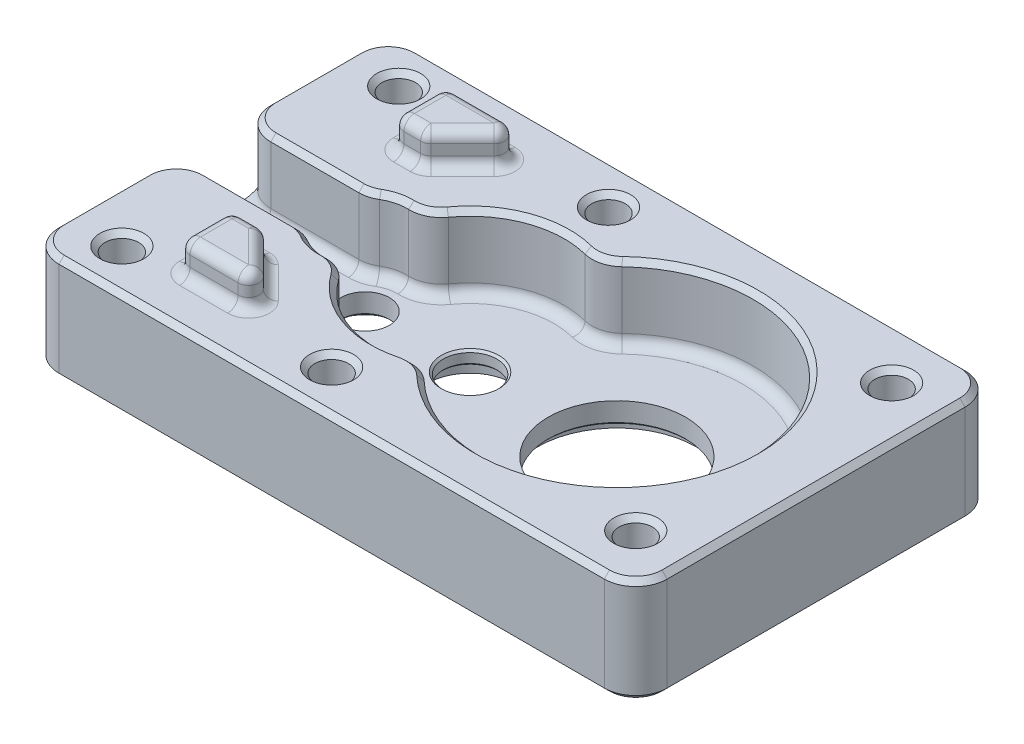
from build123d import *

# Parameters (mm, degrees)
BOSS_EXTRUDE1_DEPTH  = 3
SKETCH2_R            = 3.85
CUT_EXTRUDE1_DEPTH   = 1
SKETCH3_R            = 2.3
CUT_EXTRUDE2_DEPTH   = 47.35558218812488
BOSS_EXTRUDE2_DEPTH  = 7
CUT_EXTRUDE3_DEPTH   = 7
SKETCH6_R            = 4.099999999999999
CUT_EXTRUDE4_DEPTH   = 1.7
SKETCH7_R            = 2.5500000000000007
CUT_EXTRUDE5_DEPTH   = 48.05029224138783
SKETCH8_R            = 7.6000000000000005
CUT_EXTRUDE6_DEPTH   = 1
SKETCH9_R            = 6.550000000000002
CUT_EXTRUDE7_DEPTH   = 48.17880880225782
FILLET1_R            = 3
FILLET2_R            = 3
FILLET3_R            = 1
CHAMFER1_SIZE        = 0.2
SKETCH10_R           = 1.6
SKETCH10_R_2         = 1.6000000000000019
CUT_EXTRUDE8_DEPTH   = 48.37974265485198
SKETCH11_R           = 1.5999999999999979
CUT_EXTRUDE9_DEPTH   = 48.37974265485198
SKETCH12_R           = 2.0999999999999974
CUT_EXTRUDE10_DEPTH  = 5
BOSS_EXTRUDE3_DEPTH  = 3
FILLET4_R            = 1
FILLET5_R            = 1
FILLET4_OF_MIRROR2_R = 1
FILLET5_OF_MIRROR2_R = 1
CHAMFER2_SIZE        = 0.5


with BuildPart() as part:
    # Sketch1 → Boss-Extrude1 (new body)
    with BuildSketch(Plane(origin=(0, 27.999999999999996, 0), x_dir=(1, 0, 0), z_dir=(0, 1, 0))):
        Polygon((43, -17.199999999999992), (-15, -17.2), (-15, 17.2), (43, 17.199999999999992), align=None)
    extrude(amount=BOSS_EXTRUDE1_DEPTH)

    # Sketch2 → Cut-Extrude1 (cut)
    with BuildSketch(Plane.XZ.offset(-27.999999999999996)):
        with Locations(Location((0, 0, 0), (0, 0, 270))):
            Circle(SKETCH2_R)
    extrude(amount=-CUT_EXTRUDE1_DEPTH, mode=Mode.SUBTRACT)

    # Sketch3 → Cut-Extrude2 (cut, through all)
    with BuildSketch(Plane.XZ.offset(-28.999999999999996)):
        with Locations(Location((0, 0, 0), (0, 0, 270))):
            Circle(SKETCH3_R)
    extrude(amount=-CUT_EXTRUDE2_DEPTH, mode=Mode.SUBTRACT)

    # Sketch4 → Boss-Extrude2 (add)
    with BuildSketch(Plane(origin=(0, 30.999999999999996, 0), x_dir=(1, 0, 0), z_dir=(0, 1, 0))):
        Polygon((-15, -17.2), (43, -17.199999999999992), (43, 17.199999999999992), (-15, 17.2), align=None)
        with BuildLine():
            ThreePointArc((1.7500000000000029, 3.596873642484539), (-4.000000000000001, 4.9e-16), (1.7500000000000029, -3.596873642484539))
            ThreePointArc((1.7500000000000029, -3.596873642484539), (6.8432344422697495, -8.428216372016559), (13.85714285714286, -8.131571126147259))
            ThreePointArc((13.85714285714286, -8.131571126147259), (37, 0), (13.85714285714286, 8.131571126147259))
            ThreePointArc((13.85714285714286, 8.131571126147259), (6.843234442269749, 8.42821637201656), (1.7500000000000029, 3.596873642484539))
        make_face(mode=Mode.SUBTRACT)
    extrude(amount=BOSS_EXTRUDE2_DEPTH)

    # Sketch5 → Cut-Extrude3 (cut)
    with BuildSketch(Plane(origin=(0, 38, 0), x_dir=(1, 0, 0), z_dir=(0, 1, 0))):
        Polygon((-2.6457513110645925, 2.9999999999999982), (-2.6457513110645925, -2.9999999999999982), (-15, -3), (-15, 3), align=None)
    extrude(amount=-CUT_EXTRUDE3_DEPTH, mode=Mode.SUBTRACT)

    # Sketch6 → Cut-Extrude4 (cut)
    with BuildSketch(Plane.XZ.offset(-27.999999999999996)):
        with Locations(Location((10, 0, 0), (0, 0, 270))):
            Circle(SKETCH6_R)
    extrude(amount=-CUT_EXTRUDE4_DEPTH, mode=Mode.SUBTRACT)

    # Sketch7 → Cut-Extrude5 (cut, through all)
    with BuildSketch(Plane.XZ.offset(-29.699999999999996)):
        with Locations(Location((10, 0, 0), (0, 0, 270))):
            Circle(SKETCH7_R)
    extrude(amount=-CUT_EXTRUDE5_DEPTH, mode=Mode.SUBTRACT)

    # Sketch8 → Cut-Extrude6 (cut)
    with BuildSketch(Plane.XZ.offset(-27.999999999999996)):
        with Locations(Location((24, 0, 0), (0, 0, 270))):
            Circle(SKETCH8_R)
    extrude(amount=-CUT_EXTRUDE6_DEPTH, mode=Mode.SUBTRACT)

    # Sketch9 → Cut-Extrude7 (cut, through all)
    with BuildSketch(Plane.XZ.offset(-28.999999999999996)):
        with Locations(Location((24, 0, 0), (0, 0, 270))):
            Circle(SKETCH9_R)
    extrude(amount=-CUT_EXTRUDE7_DEPTH, mode=Mode.SUBTRACT)

    # Fillet1
    fillet1_edges = [part.edges().sort_by_distance(p)[0] for p in [
        (43, 33, 17.199999999999992),
        (43, 33, -17.199999999999992),
        (-15, 33, -17.2),
        (-15, 33, 17.2),
    ]]
    fillet(fillet1_edges, radius=FILLET1_R)

    # Fillet2
    fillet2_edges = [part.edges().sort_by_distance(p)[0] for p in [
        (1.750000000000003, 34.5, -3.596873642484539),
        (1.750000000000003, 34.5, 3.5968736424845384),
        (13.85714285714286, 34.5, 8.13157112614726),
        (13.857142857142863, 34.5, -8.131571126147264),
        (-15, 34.5, -3),
        (-2.6457513110645925, 34.5, -2.9999999999999982),
        (-2.6457513110645925, 34.5, 2.9999999999999982),
        (-15, 34.5, 3),
    ]]
    fillet(fillet2_edges, radius=FILLET2_R)

    # Fillet3
    fillet3_edges = [part.edges().sort_by_distance(p)[0] for p in [
        (-7.802775637731996, 31, 2.999999999999999),
        (-7.802775637731997, 31, -2.999999999999999),
        (6.931902414879216, 30.999999999999996, 8.460896950570664),
        (37, 30.999999999999996, 5.33e-15),
        (-1.0000331784075014, 30.999999999999996, 3.8729747794278486),
        (-1.0000331784075025, 30.999999999999996, -3.8729747794278486),
        (6.9319024148792145, 30.999999999999996, -8.460896950570664),
        (-14.121320343559642, 31, 3.878679656440358),
        (-14.121320343559642, 31, -3.8786796564403576),
        (13.75000000000006, 31, 8.714212528966701),
        (1.57203171563431, 31, 4.302537419625892),
        (-2.8037675497267185, 31, 3.1091276650217043),
        (-2.803767549726719, 31, -3.1091276650217043),
        (13.749999999999947, 31, -8.714212528966673),
        (1.5720317156342107, 31, -4.302537419625842),
    ]]
    fillet(fillet3_edges, radius=FILLET3_R)

    # Chamfer1
    chamfer1_edges = [part.edges().sort_by_distance(p)[0] for p in [
        (7e-16, 28.999999999999996, 2.3),
        (10, 31, 2.5500000000000007),
        (10, 29.699999999999996, 2.5500000000000007),
        (24.000000000000004, 28.999999999999996, 6.550000000000002),
    ]]
    chamfer(chamfer1_edges, length=CHAMFER1_SIZE)

    # Sketch10 → Cut-Extrude8 (cut, through all)
    with BuildSketch(Plane.XZ.offset(-27.999999999999996)):
        with Locations(Location((-10.000000000000004, -13.200000000000005, 0), (0, 0, 270))):
            Circle(SKETCH10_R)
        with Locations(Location((9.999999999999996, -13.200000000000005, 0), (0, 0, 270))):
            Circle(SKETCH10_R)
        with Locations(Location((-10.000000000000004, 13.199999999999994, 0), (0, 0, 270))):
            Circle(SKETCH10_R)
        with Locations(Location((9.999999999999996, 13.199999999999994, 0), (0, 0, 270))):
            Circle(SKETCH10_R_2)
    extrude(amount=-CUT_EXTRUDE8_DEPTH, mode=Mode.SUBTRACT)

    # Sketch11 → Cut-Extrude9 (cut, through all)
    with BuildSketch(Plane.XZ.offset(-27.999999999999996)):
        with Locations(Location((38.00000000000001, -12.199999999999992, 0), (0, 0, 270))):
            Circle(SKETCH11_R)
    cut_extrude9 = extrude(amount=-CUT_EXTRUDE9_DEPTH, mode=Mode.SUBTRACT)

    # Sketch12 → Cut-Extrude10 (cut)
    with BuildSketch(Plane.XZ.offset(-27.999999999999996)):
        with Locations(Location((38.00000000000001, -12.199999999999992, 0), (0, 0, 270))):
            Circle(SKETCH12_R)
    cut_extrude10 = extrude(amount=-CUT_EXTRUDE10_DEPTH, mode=Mode.SUBTRACT)

    # Mirror1: Cut-Extrude9, Cut-Extrude10 across plane
    add(cut_extrude9.mirror(Plane.XY), mode=Mode.SUBTRACT)
    add(cut_extrude10.mirror(Plane.XY), mode=Mode.SUBTRACT)

    # Sketch13 → Boss-Extrude3 (add)
    with BuildSketch(Plane(origin=(0, 38, 0), x_dir=(1, 0, 0), z_dir=(0, 1, 0))):
        Polygon((3.000000000000001, -12.7), (-4.999999999999999, -12.700000000000001), (-4.999999999999999, -7.700000000000001), (-2.0000000000000533, -7.700000000000001), align=None)
    boss_extrude3 = extrude(amount=BOSS_EXTRUDE3_DEPTH)

    # Fillet4
    fillet4_edges = [part.edges().sort_by_distance(p)[0] for p in [
        (3.000000000000001, 39.5, 12.7),
        (-2.0000000000000533, 39.5, 7.700000000000001),
        (-4.999999999999999, 39.5, 7.700000000000001),
        (-4.999999999999999, 39.5, 12.700000000000001),
        (0.4999999999999738, 41, 10.2),
        (-3.500000000000026, 41, 7.700000000000001),
        (-4.999999999999999, 41, 10.200000000000001),
        (-0.9999999999999991, 41, 12.7),
    ]]
    fillet(fillet4_edges, radius=FILLET4_R)

    # Fillet5
    fillet5_edges = [part.edges().sort_by_distance(p)[0] for p in [
        (-1.7071067811865541, 38, 12.700000000000001),
        (-4.999999999999999, 38, 10.200000000000001),
        (-3.207106781186571, 38, 7.700000000000001),
        (-0.20710678118658454, 38, 9.49289321881345),
        (-2.031530130008058, 38, 7.776120467488713),
        (-4.707106781186546, 38, 7.992893218813453),
        (-4.707106781186547, 38, 12.407106781186549),
        (1.5096659701381776, 38, 12.082683432365087),
    ]]
    fillet(fillet5_edges, radius=FILLET5_R)

    # Mirror2: Boss-Extrude3 across plane
    add(boss_extrude3.mirror(Plane.XY))

    # Fillet4 of Mirror2
    fillet4_of_mirror2_edges = [part.edges().sort_by_distance(p)[0] for p in [
        (3.000000000000001, 39.5, -12.7),
        (-2.0000000000000533, 39.5, -7.700000000000001),
        (-4.999999999999999, 39.5, -7.700000000000001),
        (-4.999999999999999, 39.5, -12.700000000000001),
        (0.4999999999999738, 41, -10.2),
        (-3.500000000000026, 41, -7.700000000000001),
        (-4.999999999999999, 41, -10.200000000000001),
        (-0.9999999999999991, 41, -12.7),
    ]]
    fillet(fillet4_of_mirror2_edges, radius=FILLET4_OF_MIRROR2_R)

    # Fillet5 of Mirror2
    fillet5_of_mirror2_edges = [part.edges().sort_by_distance(p)[0] for p in [
        (-1.7071067811865541, 38, -12.700000000000001),
        (-4.999999999999999, 38, -10.200000000000001),
        (-3.207106781186571, 38, -7.700000000000001),
        (-0.20710678118658454, 38, -9.49289321881345),
        (-2.031530130008058, 38, -7.776120467488713),
        (-4.707106781186546, 38, -7.992893218813453),
        (-4.707106781186547, 38, -12.407106781186549),
        (1.5096659701381776, 38, -12.082683432365087),
    ]]
    fillet(fillet5_of_mirror2_edges, radius=FILLET5_OF_MIRROR2_R)

    # Chamfer2
    chamfer2_edges = [part.edges().sort_by_distance(p)[0] for p in [
        (-7.802775637731996, 38, 2.999999999999999),
        (-15, 38, 10.099999999999998),
        (-7.802775637731997, 38, -2.999999999999999),
        (-1.0000331784075025, 38, -3.8729747794278486),
        (6.931902414879216, 38, -8.460896950570667),
        (37, 38, 0),
        (6.931902414879216, 38, 8.460896950570662),
        (-1.0000331784075014, 38, 3.8729747794278486),
        (1.5720317156342112, 38, -4.302537419625842),
        (13.749999999999948, 38, -8.714212528966673),
        (-2.803767549726719, 38, -3.1091276650217043),
        (-2.8037675497267185, 38, 3.1091276650217043),
        (1.5720317156343104, 38, 4.302537419625892),
        (13.750000000000053, 38, 8.714212528966698),
        (-14.121320343559642, 38, -3.8786796564403576),
        (-14.121320343559642, 38, 3.878679656440358),
        (9.999999999999996, 38, -11.600000000000005),
        (9.999999999999996, 27.999999999999996, -11.600000000000005),
        (-10.000000000000004, 38, 14.799999999999994),
        (-10.000000000000004, 27.999999999999996, 14.799999999999994),
        (9.999999999999996, 38, 14.799999999999995),
        (9.999999999999996, 27.999999999999996, 14.799999999999995),
        (-10.000000000000004, 38, -11.600000000000005),
        (-10.000000000000004, 27.999999999999996, -11.600000000000005),
        (38.00000000000001, 38, -10.599999999999994),
        (38.00000000000001, 27.999999999999996, -10.099999999999994),
        (38.00000000000001, 38, 10.599999999999994),
        (38.00000000000001, 27.999999999999996, 10.099999999999994),
        (14, 27.999999999999996, 17.199999999999996),
        (14, 38, 17.199999999999996),
        (-15, 27.999999999999996, 0),
        (14, 27.999999999999996, -17.199999999999996),
        (43, 27.999999999999996, 0),
        (-14.121320343559642, 27.999999999999996, -16.32132034355964),
        (42.121320343559645, 27.999999999999996, -16.321320343559634),
        (42.121320343559645, 27.999999999999996, 16.321320343559634),
        (-14.121320343559642, 27.999999999999996, 16.32132034355964),
        (-15, 38, -10.1),
        (43, 38, 0),
        (14, 38, -17.199999999999996),
        (-14.121320343559642, 38, -16.32132034355964),
        (42.121320343559645, 38, -16.321320343559634),
        (42.121320343559645, 38, 16.321320343559634),
        (-14.121320343559642, 38, 16.32132034355964),
    ]]
    chamfer(chamfer2_edges, length=CHAMFER2_SIZE)


solid = part.part
